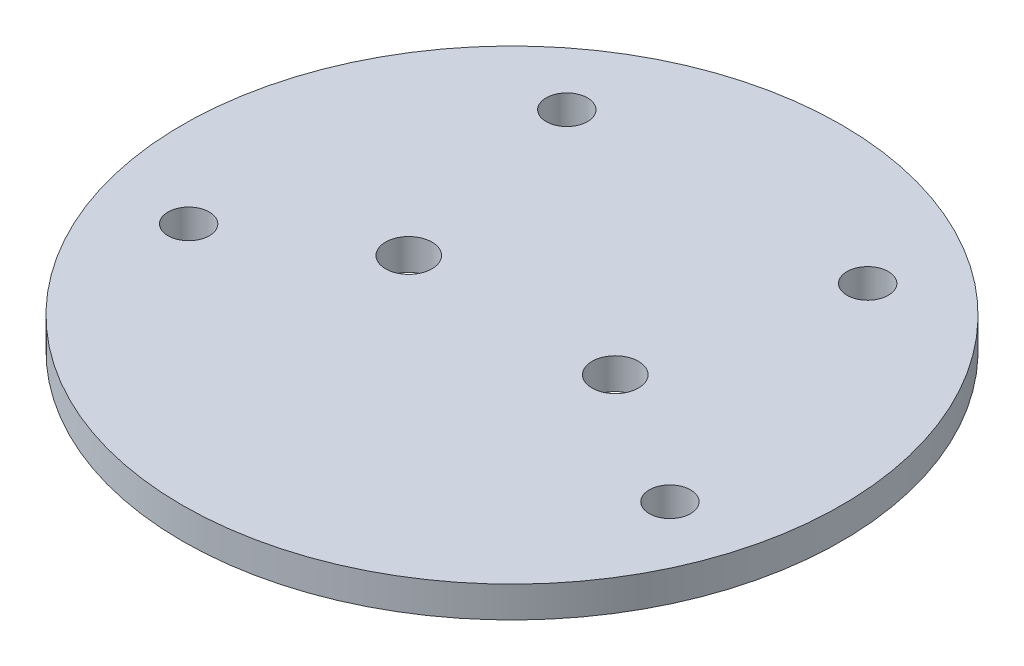
from build123d import *

# Parameters (mm, degrees)
SKETCH1_R           = 50.673
SKETCH1_R_2         = 3.5687
SKETCH1_R_3         = 3.175
BOSS_EXTRUDE1_DEPTH = 4.7752


with BuildPart() as part:
    # Sketch1 → Boss-Extrude1 (new body)
    with BuildSketch(Plane(origin=(0, 0, 0), x_dir=(1, 0, 0), z_dir=(0, 1, 0))):
        with Locations(Location((0, 0, 0), (0, 0, 270))):
            Circle(SKETCH1_R)
        with Locations(Location((-15.875, 0, 0), (0, 0, 270))):
            Circle(SKETCH1_R_2, mode=Mode.SUBTRACT)
        with Locations(Location((15.875, 0, 0), (0, 0, 270))):
            Circle(SKETCH1_R_2, mode=Mode.SUBTRACT)
        with Locations(Location((-37.000474805, -12.718618741, 0), (0, 0, 270))):
            Circle(SKETCH1_R_3, mode=Mode.SUBTRACT)
        with Locations(Location((-23.12973035, 31.556520284, 0), (0, 0, 270))):
            Circle(SKETCH1_R_3, mode=Mode.SUBTRACT)
        with Locations(Location((23.12973035, 31.556520284, 0), (0, 0, 90))):
            Circle(SKETCH1_R_3, mode=Mode.SUBTRACT)
        with Locations(Location((37.000474805, -12.718618741, 0), (0, 0, 90))):
            Circle(SKETCH1_R_3, mode=Mode.SUBTRACT)
    extrude(amount=BOSS_EXTRUDE1_DEPTH)


solid = part.part
